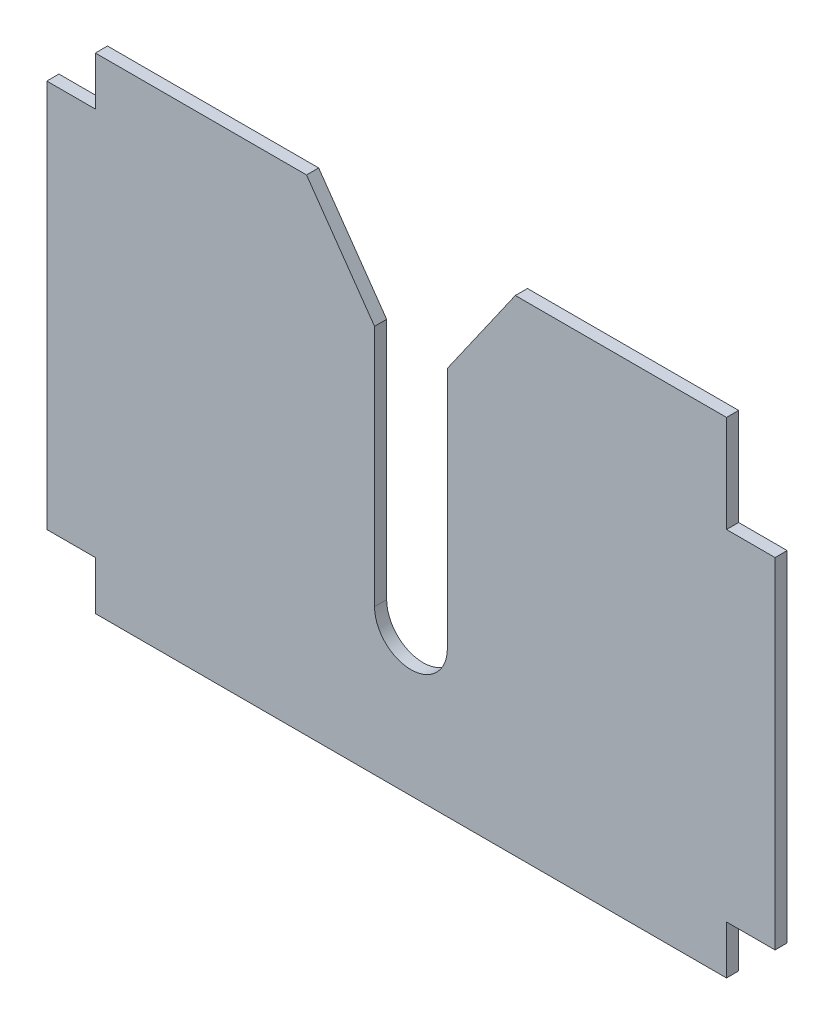
from build123d import *

# Parameters (mm, degrees)
SKETCH1_W           = 300
SKETCH1_H           = 200
BOSS_EXTRUDE1_DEPTH = 5
SKETCH3_W           = 20
SKETCH3_H           = 20
SKETCH3_H_2         = 40
CUT_EXTRUDE1_DEPTH  = 5
CUT_EXTRUDE2_DEPTH  = 10
SKETCH5_W           = 20
SKETCH5_H           = 20
BOSS_EXTRUDE2_DEPTH = 5


with BuildPart() as part:
    # Sketch1 → Boss-Extrude1 (new body)
    with BuildSketch(Plane.XY):
        Rectangle(SKETCH1_W, SKETCH1_H)
    extrude(amount=BOSS_EXTRUDE1_DEPTH)

    # Sketch3 → Cut-Extrude1 (cut)
    with BuildSketch(Plane.XY.offset(5)):
        with Locations((-140, -90)):
            Rectangle(SKETCH3_W, SKETCH3_H)
        with Locations((-140, 80)):
            Rectangle(SKETCH3_W, SKETCH3_H_2)
        with Locations((140, 80)):
            Rectangle(SKETCH3_W, SKETCH3_H_2)
        with Locations((140, -90)):
            Rectangle(SKETCH3_W, SKETCH3_H)
    extrude(amount=-CUT_EXTRUDE1_DEPTH, mode=Mode.SUBTRACT)

    # Sketch4 → Cut-Extrude2 (cut)
    with BuildSketch(Plane.XY.offset(5)):
        with BuildLine():
            Line((-15, -40), (-15, 60))
            Line((-15, 60), (-43.008301528, 100))
            Line((-43.008301528, 100), (43.008301528, 100))
            Line((43.008301528, 100), (15, 60))
            Line((15, 60), (15, -40))
            ThreePointArc((15, -40), (0, -55), (-15, -40))
        make_face()
    extrude(amount=-CUT_EXTRUDE2_DEPTH, mode=Mode.SUBTRACT)

    # Sketch5 → Boss-Extrude2 (add)
    with BuildSketch(Plane.XY.offset(5)):
        with Locations((-140, 70)):
            Rectangle(SKETCH5_W, SKETCH5_H)
    extrude(amount=-BOSS_EXTRUDE2_DEPTH)


solid = part.part
